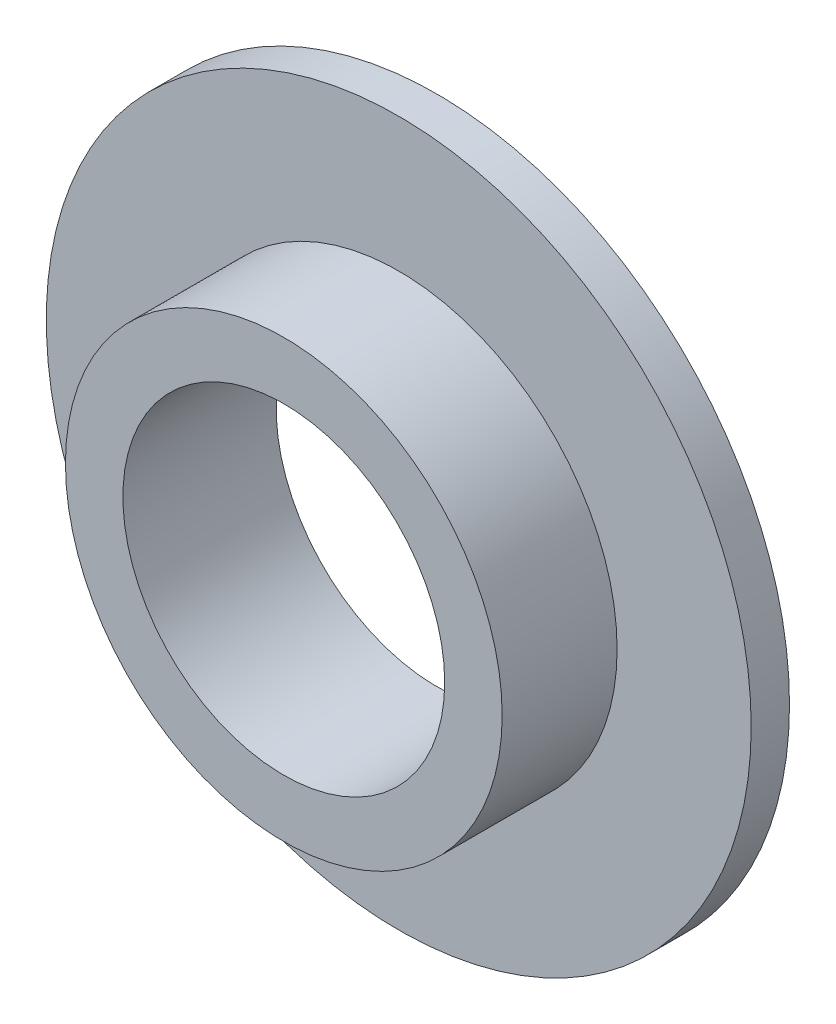
from build123d import *

# Parameters (mm, degrees)
CROQUIS1_R              = 18.4
CROQUIS1_R_2            = 8.4
SALIENTE_EXTRUIR1_DEPTH = 1
CROQUIS2_R              = 11.4
CROQUIS2_R_2            = 8.4
SALIENTE_EXTRUIR2_DEPTH = 6


with BuildPart() as part:
    # Croquis1 → Saliente-Extruir1 (new, symmetric)
    with BuildSketch(Plane.XY):
        Circle(CROQUIS1_R)
        Circle(CROQUIS1_R_2, mode=Mode.SUBTRACT)
    extrude(amount=SALIENTE_EXTRUIR1_DEPTH, both=True)

    # Croquis2 → Saliente-Extruir2 (add)
    with BuildSketch(Plane.XY.offset(1)):
        Circle(CROQUIS2_R)
        Circle(CROQUIS2_R_2, mode=Mode.SUBTRACT)
    extrude(amount=SALIENTE_EXTRUIR2_DEPTH)


solid = part.part
